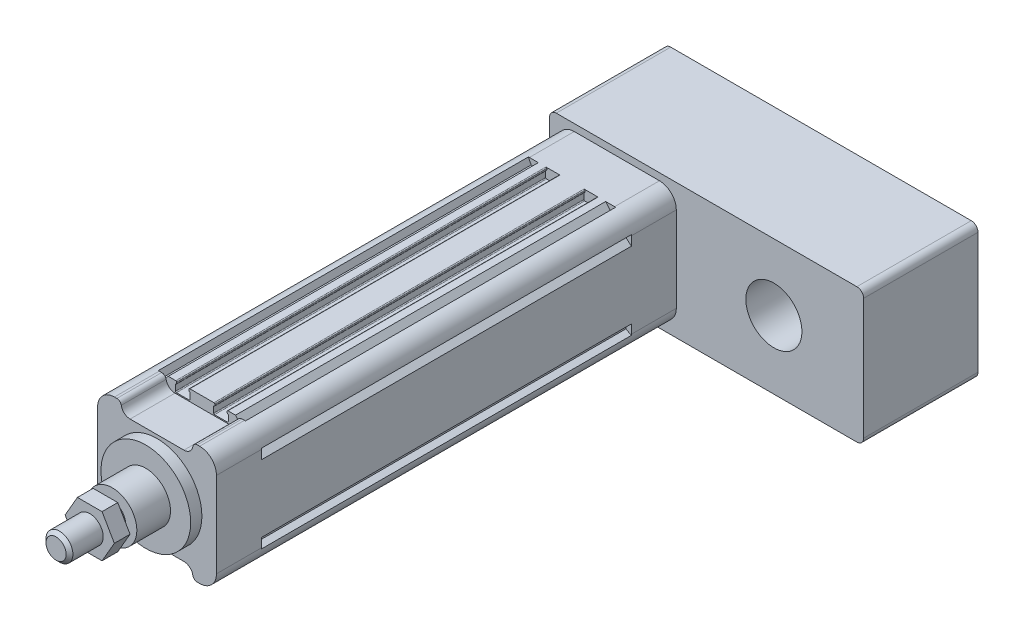
from build123d import *

# Parameters (mm, degrees)
SKETCH_1_R                  = 2.1
EXTRUDE_1_DEPTH             = 165
EXTRUDE_2_DEPTH             = 20
SKETCH_7_R                  = 20
EXTRUDE_3_DEPTH             = 5
SKETCH_9_R                  = 11
EXTRUDE_4_DEPTH             = 15
SKETCH_10_R                 = 6
EXTRUDE_5_DEPTH             = 25
EXTRUDE_START               = 20
EXTRUDE_6_DEPTH             = 20
EXTRUDE_7_DEPTH             = 51
SKETCH_13_R                 = 12.5
CUT_EXTRUDE_2_DEPTH         = 30
PATTERN_LINEAR_1_COUNT      = 2
PATTERN_LINEAR_1_PITCH      = 38
PATTERN_LINEAR_1_COUNT_DIR2 = 2
PATTERN_LINEAR_1_PITCH_DIR2 = 38
HOLE_WIZARD_M6_2_D          = 5
HOLE_WIZARD_M6_2_DEPTH      = 15
HOLE_WIZARD_M6_2_TIP        = 1.502151548
HOLE_WIZARD_M6_3_D          = 5
HOLE_WIZARD_M6_3_DEPTH      = 15
HOLE_WIZARD_M6_3_TIP        = 1.502151548
HOLE_WIZARD_M6_4_D          = 5
HOLE_WIZARD_M6_4_DEPTH      = 15
HOLE_WIZARD_M6_4_TIP        = 1.502151548
CHAMFER_1_SIZE              = 1.5
EXTRUDE_START_2             = 3
EXTRUDE_8_DEPTH             = 7


with BuildPart() as part:
    # 草图1 → 凸台-拉伸1 (new body)
    with BuildSketch(Plane.XY):
        with BuildLine():
            Line((-18.2, 24), (-19.443439638, 26.486879276))
            ThreePointArc((-19.443439638, 26.486879276), (-24.303300859, 24.303300859), (-26.486879276, 19.443439638))
            Line((-26.486879276, 19.443439638), (-24, 18.2))
            Line((-24, 18.2), (-24, 17.1))
            Line((-24, 17.1), (-26.5, 15))
            Line((-26.5, 15), (-26.5, -15))
            Line((-26.5, -15), (-24, -17.1))
            Line((-24, -17.1), (-24, -18.2))
            Line((-24, -18.2), (-26.486879276, -19.443439638))
            ThreePointArc((-26.486879276, -19.443439638), (-24.303300859, -24.303300859), (-19.443439638, -26.486879276))
            Line((-19.443439638, -26.486879276), (-18.2, -24))
            Line((-18.2, -24), (-17.1, -24))
            Line((-17.1, -24), (-15, -26.5))
            Line((-15, -26.5), (-11.65, -26.5))
            ThreePointArc((-11.65, -26.5), (-11.367157288, -26.382842712), (-11.25, -26.1))
            Line((-11.25, -26.1), (-11.25, -25.6))
            ThreePointArc((-11.25, -25.6), (-11.367157288, -25.317157288), (-11.65, -25.2))
            Line((-11.65, -25.2), (-11.75, -25.2))
            Line((-11.75, -25.2), (-11.75, -22.4))
            ThreePointArc((-11.75, -22.4), (-11.632842712, -22.117157288), (-11.35, -22))
            Line((-11.35, -22), (-5.65, -22))
            ThreePointArc((-5.65, -22), (-5.367157288, -22.117157288), (-5.25, -22.4))
            Line((-5.25, -22.4), (-5.25, -25.2))
            Line((-5.25, -25.2), (-5.35, -25.2))
            ThreePointArc((-5.35, -25.2), (-5.632842712, -25.317157288), (-5.75, -25.6))
            Line((-5.75, -25.6), (-5.75, -26.1))
            ThreePointArc((-5.75, -26.1), (-5.632842712, -26.382842712), (-5.35, -26.5))
            Line((-5.35, -26.5), (5.35, -26.5))
            ThreePointArc((5.35, -26.5), (5.632842712, -26.382842712), (5.75, -26.1))
            Line((5.75, -26.1), (5.75, -25.6))
            ThreePointArc((5.75, -25.6), (5.632842712, -25.317157288), (5.35, -25.2))
            Line((5.35, -25.2), (5.25, -25.2))
            Line((5.25, -25.2), (5.25, -22.4))
            ThreePointArc((5.25, -22.4), (5.367157288, -22.117157288), (5.65, -22))
            Line((5.65, -22), (11.35, -22))
            ThreePointArc((11.35, -22), (11.632842712, -22.117157288), (11.75, -22.4))
            Line((11.75, -22.4), (11.75, -25.2))
            Line((11.75, -25.2), (11.65, -25.2))
            ThreePointArc((11.65, -25.2), (11.367157288, -25.317157288), (11.25, -25.6))
            Line((11.25, -25.6), (11.25, -26.1))
            ThreePointArc((11.25, -26.1), (11.367157288, -26.382842712), (11.65, -26.5))
            Line((11.65, -26.5), (15, -26.5))
            Line((15, -26.5), (17.1, -24))
            Line((17.1, -24), (18.2, -24))
            Line((18.2, -24), (19.443439638, -26.486879276))
            ThreePointArc((19.443439638, -26.486879276), (24.303300859, -24.303300859), (26.486879276, -19.443439638))
            Line((26.486879276, -19.443439638), (24, -18.2))
            Line((24, -18.2), (24, -17.1))
            Line((24, -17.1), (26.5, -15))
            Line((26.5, -15), (26.5, 15))
            Line((26.5, 15), (24, 17.1))
            Line((24, 17.1), (24, 18.2))
            Line((24, 18.2), (26.486879276, 19.443439638))
            ThreePointArc((26.486879276, 19.443439638), (24.303300859, 24.303300859), (19.443439638, 26.486879276))
            Line((19.443439638, 26.486879276), (18.2, 24))
            Line((18.2, 24), (17.1, 24))
            Line((17.1, 24), (15, 26.5))
            Line((15, 26.5), (11.65, 26.5))
            ThreePointArc((11.65, 26.5), (11.367157288, 26.382842712), (11.25, 26.1))
            Line((11.25, 26.1), (11.25, 25.6))
            ThreePointArc((11.25, 25.6), (11.367157288, 25.317157288), (11.65, 25.2))
            Line((11.65, 25.2), (11.75, 25.2))
            Line((11.75, 25.2), (11.75, 22.4))
            ThreePointArc((11.75, 22.4), (11.632842712, 22.117157288), (11.35, 22))
            Line((11.35, 22), (5.65, 22))
            ThreePointArc((5.65, 22), (5.367157288, 22.117157288), (5.25, 22.4))
            Line((5.25, 22.4), (5.25, 25.2))
            Line((5.25, 25.2), (5.35, 25.2))
            ThreePointArc((5.35, 25.2), (5.632842712, 25.317157288), (5.75, 25.6))
            Line((5.75, 25.6), (5.75, 26.1))
            ThreePointArc((5.75, 26.1), (5.632842712, 26.382842712), (5.35, 26.5))
            Line((5.35, 26.5), (-5.35, 26.5))
            ThreePointArc((-5.35, 26.5), (-5.632842712, 26.382842712), (-5.75, 26.1))
            Line((-5.75, 26.1), (-5.75, 25.6))
            ThreePointArc((-5.75, 25.6), (-5.632842712, 25.317157288), (-5.35, 25.2))
            Line((-5.35, 25.2), (-5.25, 25.2))
            Line((-5.25, 25.2), (-5.25, 22.4))
            ThreePointArc((-5.25, 22.4), (-5.367157288, 22.117157288), (-5.65, 22))
            Line((-5.65, 22), (-11.35, 22))
            ThreePointArc((-11.35, 22), (-11.632842712, 22.117157288), (-11.75, 22.4))
            Line((-11.75, 22.4), (-11.75, 25.2))
            Line((-11.75, 25.2), (-11.65, 25.2))
            ThreePointArc((-11.65, 25.2), (-11.367157288, 25.317157288), (-11.25, 25.6))
            Line((-11.25, 25.6), (-11.25, 26.1))
            ThreePointArc((-11.25, 26.1), (-11.367157288, 26.382842712), (-11.65, 26.5))
            Line((-11.65, 26.5), (-15, 26.5))
            Line((-15, 26.5), (-17.1, 24))
            Line((-17.1, 24), (-18.2, 24))
        make_face()
        with Locations((19, 19)):
            Circle(SKETCH_1_R, mode=Mode.SUBTRACT)
        with Locations((19, -19)):
            Circle(SKETCH_1_R, mode=Mode.SUBTRACT)
        with Locations((-19, -19)):
            Circle(SKETCH_1_R, mode=Mode.SUBTRACT)
        with Locations((-19, 19)):
            Circle(SKETCH_1_R, mode=Mode.SUBTRACT)
        with BuildLine():
            Line((19.773719933, 3), (23.3, 3))
            Line((23.3, 3), (23.3, -3))
            Line((23.3, -3), (19.773719933, -3))
            ThreePointArc((19.773719933, -3), (0, -20), (-19.773719933, -3))
            Line((-19.773719933, -3), (-23.3, -3))
            Line((-23.3, -3), (-23.3, 3))
            Line((-23.3, 3), (-19.773719933, 3))
            ThreePointArc((-19.773719933, 3), (0, 20), (19.773719933, 3))
        make_face(mode=Mode.SUBTRACT)
    extrude(amount=EXTRUDE_1_DEPTH)

    # 草图6 → 凸台-拉伸2 (add)
    with BuildSketch(Plane.XY.offset(165)):
        with BuildLine():
            Line((-26.5, -19), (-26.5, 19))
            ThreePointArc((-26.5, 19), (-24.303300859, 24.303300859), (-19, 26.5))
            Line((-19, 26.5), (-17.916079783, 26.5))
            ThreePointArc((-17.916079783, 26.5), (-16.625085334, 26.027525232), (-15.944053189, 24.833333333))
            ThreePointArc((-15.944053189, 24.833333333), (-14.581988897, 22.444949537), (-12, 21.5))
            Line((-12, 21.5), (12, 21.5))
            ThreePointArc((12, 21.5), (14.581988897, 22.444949537), (15.944053189, 24.833333333))
            ThreePointArc((15.944053189, 24.833333333), (16.625085334, 26.027525232), (17.916079783, 26.5))
            Line((17.916079783, 26.5), (19, 26.5))
            ThreePointArc((19, 26.5), (24.303300859, 24.303300859), (26.5, 19))
            Line((26.5, 19), (26.5, -19))
            ThreePointArc((26.5, -19), (24.303300859, -24.303300859), (19, -26.5))
            Line((19, -26.5), (17.916079783, -26.5))
            ThreePointArc((17.916079783, -26.5), (16.625085334, -26.027525232), (15.944053189, -24.833333333))
            ThreePointArc((15.944053189, -24.833333333), (14.581988897, -22.444949537), (12, -21.5))
            Line((12, -21.5), (-12, -21.5))
            ThreePointArc((-12, -21.5), (-14.581988897, -22.444949537), (-15.944053189, -24.833333333))
            ThreePointArc((-15.944053189, -24.833333333), (-16.625085334, -26.027525232), (-17.916079783, -26.5))
            Line((-17.916079783, -26.5), (-19, -26.5))
            ThreePointArc((-19, -26.5), (-24.303300859, -24.303300859), (-26.5, -19))
        make_face()
    extrude(amount=EXTRUDE_2_DEPTH)

    # 草图7 → 凸台-拉伸3 (add)
    with BuildSketch(Plane.XY.offset(185)):
        Circle(SKETCH_7_R)
    extrude(amount=EXTRUDE_3_DEPTH)

    # 草图9 → 凸台-拉伸4 (add)
    with BuildSketch(Plane.XY.offset(190)):
        Circle(SKETCH_9_R)
    extrude(amount=EXTRUDE_4_DEPTH)

    # 草图10 → 凸台-拉伸5 (add)
    with BuildSketch(Plane.XY.offset(205)):
        Circle(SKETCH_10_R)
    extrude(amount=EXTRUDE_5_DEPTH)

    # 草图11 → 凸台-拉伸6 (add)
    with BuildSketch(Plane(origin=(0, 0, 0), x_dir=(-1, 0, 0), z_dir=(0, 0, -1)).offset(EXTRUDE_START)):
        with BuildLine():
            Line((-19, -26.5), (19, -26.5))
            ThreePointArc((19, -26.5), (24.303300859, -24.303300859), (26.5, -19))
            Line((26.5, -19), (26.5, 19))
            ThreePointArc((26.5, 19), (24.303300859, 24.303300859), (19, 26.5))
            Line((19, 26.5), (-19, 26.5))
            ThreePointArc((-19, 26.5), (-24.303300859, 24.303300859), (-26.5, 19))
            Line((-26.5, 19), (-26.5, -19))
            ThreePointArc((-26.5, -19), (-24.303300859, -24.303300859), (-19, -26.5))
        make_face()
    extrude(amount=-EXTRUDE_6_DEPTH)

    # 草图12 → 凸台-拉伸7 (add)
    with BuildSketch(Plane(origin=(0, 0, -20), x_dir=(-1, 0, 0), z_dir=(0, 0, -1))):
        with BuildLine():
            Line((-107, -30.404162038), (27, -30.404162038))
            ThreePointArc((27, -30.404162038), (29.121320344, -29.525482382), (30, -27.404162038))
            Line((30, -27.404162038), (30, 26.595837962))
            ThreePointArc((30, 26.595837962), (29.121320344, 28.717158305), (27, 29.595837962))
            Line((27, 29.595837962), (-107, 29.595837962))
            ThreePointArc((-107, 29.595837962), (-109.121320344, 28.717158305), (-110, 26.595837962))
            Line((-110, 26.595837962), (-110, -27.404162038))
            ThreePointArc((-110, -27.404162038), (-109.121320344, -29.525482382), (-107, -30.404162038))
        make_face()
    extrude(amount=EXTRUDE_7_DEPTH)

    # 草图13 → 切除-拉伸2 (cut)
    with BuildSketch(Plane.XY.offset(-20)):
        with Locations((70, 0)):
            Circle(SKETCH_13_R)
    extrude(amount=-CUT_EXTRUDE_2_DEPTH, mode=Mode.SUBTRACT)

    # 草图15 → M6 螺纹孔1 (revolve, cut)
    with BuildSketch(Plane(origin=(-19, -19, -71), x_dir=(0, 1, 0), z_dir=(1, 0, 0))):
        Polygon((0, 0), (0, 16.502151548), (2.5, 15), (2.5, 0), align=None)
    hole_wizard_m6_1 = revolve(axis=Axis((-19, -19, -77.35), (0, 0, 1)), mode=Mode.SUBTRACT)

    # 阵列(线性)1: Hole Wizard M6 _1 2 × 2
    with Locations(*[(j * PATTERN_LINEAR_1_PITCH_DIR2, i * PATTERN_LINEAR_1_PITCH, 0) for i in range(PATTERN_LINEAR_1_COUNT) for j in range(PATTERN_LINEAR_1_COUNT_DIR2) if (i, j) != (0, 0)]):
        add(hole_wizard_m6_1, mode=Mode.SUBTRACT)

    # M6 螺纹孔2
    with Locations(Plane(origin=(0, 0, -71), x_dir=(-1, 0, 0), z_dir=(0, 0, -1))):
        with Locations((-84, -19), (-84, 19)):
            Hole(HOLE_WIZARD_M6_2_D / 2, depth=HOLE_WIZARD_M6_2_DEPTH)
            with Locations((0, 0, -(HOLE_WIZARD_M6_2_DEPTH + HOLE_WIZARD_M6_2_TIP / 2))):  # 118° drill point
                Cone(0, HOLE_WIZARD_M6_2_D / 2, HOLE_WIZARD_M6_2_TIP, mode=Mode.SUBTRACT)

    # M6 螺纹孔3
    with Locations(Plane.ZY.offset(26.5)):
        with Locations((175, 11), (175, -11)):
            Hole(HOLE_WIZARD_M6_3_D / 2, depth=HOLE_WIZARD_M6_3_DEPTH)
            with Locations((0, 0, -(HOLE_WIZARD_M6_3_DEPTH + HOLE_WIZARD_M6_3_TIP / 2))):  # 118° drill point
                Cone(0, HOLE_WIZARD_M6_3_D / 2, HOLE_WIZARD_M6_3_TIP, mode=Mode.SUBTRACT)

    # M6 螺纹孔4
    with Locations(Plane.ZY.offset(26.5)):
        with Locations((-10, 11), (-10, -11)):
            Hole(HOLE_WIZARD_M6_4_D / 2, depth=HOLE_WIZARD_M6_4_DEPTH)
            with Locations((0, 0, -(HOLE_WIZARD_M6_4_DEPTH + HOLE_WIZARD_M6_4_TIP / 2))):  # 118° drill point
                Cone(0, HOLE_WIZARD_M6_4_D / 2, HOLE_WIZARD_M6_4_TIP, mode=Mode.SUBTRACT)

    # 倒角1
    chamfer_1_edges = [part.edges().sort_by_distance(p)[0] for p in [
        (-6, 0, 230),
    ]]
    chamfer(chamfer_1_edges, length=CHAMFER_1_SIZE)

    # 草图23 → 凸台-拉伸8 (add)
    with BuildSketch(Plane.XY.offset(205).offset(EXTRUDE_START_2)):
        Polygon((10.969655115, 0), (5.484827557, 9.5), (-5.484827557, 9.5), (-10.969655115, 0), (-5.484827557, -9.5), (5.484827557, -9.5), align=None)
    extrude(amount=EXTRUDE_8_DEPTH)


solid = part.part
